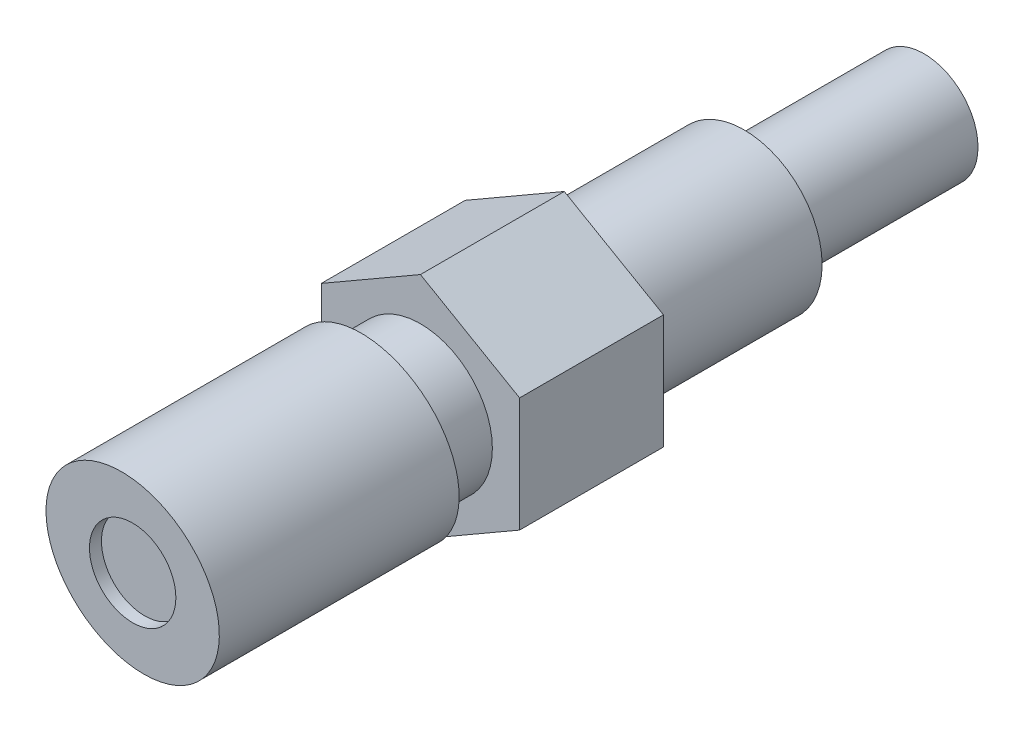
from build123d import *

# Parameters (mm, degrees)
SKETCH_1_R          = 4.5
EXTRUDE_1_DEPTH     = 15
SKETCH_2_R          = 6.5
EXTRUDE_2_DEPTH     = 15
EXTRUDE_3_DEPTH     = 12
SKETCH_4_R          = 6
EXTRUDE_4_DEPTH     = 4
SKETCH_5_RX         = 7.512684998
SKETCH_5_RY         = 6.53508396
EXTRUDE_5_DEPTH     = 20
SKETCH_6_R          = 3.603234424
CUT_EXTRUDE_1_DEPTH = 1


with BuildPart() as part:
    # ｽｹｯﾁ1 → ﾎﾞｽ - 押し出し1 (new body)
    with BuildSketch(Plane.XY):
        Circle(SKETCH_1_R)
    extrude(amount=EXTRUDE_1_DEPTH)

    # ｽｹｯﾁ2 → ﾎﾞｽ - 押し出し2 (add)
    with BuildSketch(Plane.XY.offset(15)):
        Circle(SKETCH_2_R)
    extrude(amount=EXTRUDE_2_DEPTH)

    # ｽｹｯﾁ3 → ﾎﾞｽ - 押し出し3 (add)
    with BuildSketch(Plane.XY.offset(30)):
        Polygon((0, -9.548712613), (8.269427696, -4.774356306), (8.269427696, 4.774356306), (0, 9.548712613), (-8.269427696, 4.774356306), (-8.269427696, -4.774356306), align=None)
    extrude(amount=EXTRUDE_3_DEPTH)

    # ｽｹｯﾁ4 → ﾎﾞｽ - 押し出し4 (add)
    with BuildSketch(Plane.XY.offset(42)):
        Circle(SKETCH_4_R)
    extrude(amount=EXTRUDE_4_DEPTH)

    # ｽｹｯﾁ5 → ﾎﾞｽ - 押し出し5 (add)
    with BuildSketch(Plane.XY.offset(46)):
        with Locations(Location((0, 0), (0, 0, -33.587248831))):
            Ellipse(SKETCH_5_RX, SKETCH_5_RY)
    extrude(amount=EXTRUDE_5_DEPTH)

    # ｽｹｯﾁ6 → ｶｯﾄ - 押し出し1 (cut)
    with BuildSketch(Plane.XY.offset(66)):
        Circle(SKETCH_6_R)
    extrude(amount=-CUT_EXTRUDE_1_DEPTH, mode=Mode.SUBTRACT)


solid = part.part
